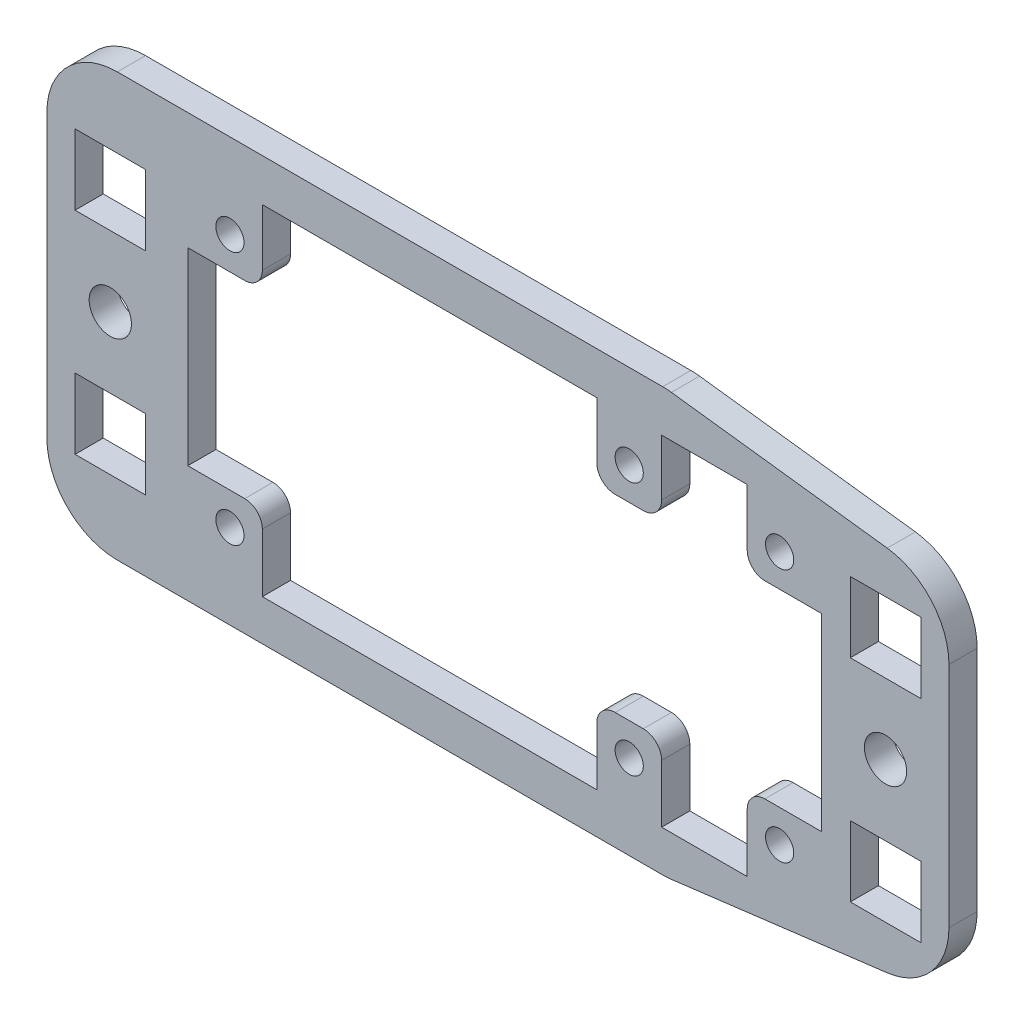
from build123d import *

# Parameters (mm, degrees)
ESQUISSE1_R        = 1.5
ESQUISSE1_W        = 5
ESQUISSE1_H        = 5
BOSS_EXTRU_1_DEPTH = 2
FILLET1_R          = 5


with BuildPart() as part:
    # Esquisse1 → Boss.-Extru.1 (new body)
    with BuildSketch(Plane.XY):
        Polygon((-10, -15), (-10, 15), (34, 15), (54, 12.5), (54, -12.5), (34, -15), align=None)
        with Locations((-5.5, 0)):
            Circle(ESQUISSE1_R, mode=Mode.SUBTRACT)
        with Locations((49.5, 0)):
            Circle(ESQUISSE1_R, mode=Mode.SUBTRACT)
        with BuildLine():
            Line((4.03758425, 6.699965485), (0, 6.699965485))
            Line((0, 6.699965485), (0, -6.699965485))
            Line((0, -6.699965485), (4.037591434, -6.700034515))
            ThreePointArc((4.037591434, -6.700034515), (4.921479782, -7.066148374), (5.28759897, -7.950034515))
            Line((5.28759897, -7.950034515), (5.28759897, -12.100034515))
            Line((5.28759897, -12.100034515), (29.015776303, -12.100034515))
            Line((29.015776303, -12.100034515), (29.015776303, -8.000038733))
            ThreePointArc((29.015776303, -8.000038733), (29.396536008, -7.080797161), (30.315776345, -6.700034473))
            Line((30.315776345, -6.700034473), (32.315776344, -6.700034473))
            ThreePointArc((32.315776344, -6.700034473), (33.23501504, -7.080795537), (33.615776345, -8.000034132))
            Line((33.615776345, -8.000034132), (33.615776345, -12.100034515))
            Line((33.615776345, -12.100034515), (39.687598777, -12.100034515))
            Line((39.687598777, -12.100034515), (39.687598777, -7.950039613))
            ThreePointArc((39.687598777, -7.950039613), (40.053713738, -7.066152541), (40.937599481, -6.70003437))
            Line((40.937599481, -6.70003437), (44.975197892, -6.70003437))
            Line((44.975197892, -6.70003437), (44.975197892, 6.699965437))
            Line((44.975197892, 6.699965437), (40.9376034, 6.699965437))
            ThreePointArc((40.9376034, 6.699965437), (40.053716981, 7.066080502), (39.68759897, 7.949965701))
            Line((39.68759897, 7.949965701), (39.68759897, 11.987564455))
            Line((39.68759897, 11.987564455), (33.615776432, 11.987564455))
            Line((33.615776432, 11.987564455), (33.615776432, 7.999969389))
            ThreePointArc((33.615776432, 7.999969389), (33.235016597, 7.080728053), (32.315776389, 6.699965495))
            Line((32.315776389, 6.699965495), (30.31577639, 6.699965495))
            ThreePointArc((30.31577639, 6.699965495), (29.396537621, 7.080726637), (29.015776399, 7.999965373))
            Line((29.015776399, 7.999965373), (29.015776399, 11.987564455))
            Line((29.015776399, 11.987564455), (5.28759897, 11.987564455))
            Line((5.28759897, 11.987564455), (5.28759897, 7.949965485))
            ThreePointArc((5.28759897, 7.949965485), (4.921477242, 7.066076805), (4.03758425, 6.699965485))
        make_face(mode=Mode.SUBTRACT)
        with BuildLine():
            ThreePointArc((31.315776387, 9.999965485), (30.315776387, 8.999965485), (31.315776387, 7.999965485))
            ThreePointArc((31.315776387, 7.999965485), (32.315776387, 8.999965485), (31.315776387, 9.999965485))
        make_face(mode=Mode.SUBTRACT)
        with BuildLine():
            ThreePointArc((42.98759897, 8.999965485), (41.98759897, 9.999965485), (40.98759897, 8.999965485))
            ThreePointArc((40.98759897, 8.999965485), (41.98759897, 7.999965485), (42.98759897, 8.999965485))
        make_face(mode=Mode.SUBTRACT)
        with BuildLine():
            ThreePointArc((42.98759897, -9.000034515), (41.98759897, -8.000034515), (40.98759897, -9.000034515))
            ThreePointArc((40.98759897, -9.000034515), (41.98759897, -10.000034515), (42.98759897, -9.000034515))
        make_face(mode=Mode.SUBTRACT)
        with BuildLine():
            ThreePointArc((31.315776387, -8.000034515), (30.315776387, -9.000034515), (31.315776387, -10.000034515))
            ThreePointArc((31.315776387, -10.000034515), (32.315776387, -9.000034515), (31.315776387, -8.000034515))
        make_face(mode=Mode.SUBTRACT)
        with BuildLine():
            ThreePointArc((1.98759897, -9.000034515), (2.98759897, -10.000034515), (3.98759897, -9.000034515))
            ThreePointArc((3.98759897, -9.000034515), (2.98759897, -8.000034515), (1.98759897, -9.000034515))
        make_face(mode=Mode.SUBTRACT)
        with BuildLine():
            ThreePointArc((1.98759897, 8.999965485), (2.98759897, 7.999965485), (3.98759897, 8.999965485))
            ThreePointArc((3.98759897, 8.999965485), (2.98759897, 9.999965485), (1.98759897, 8.999965485))
        make_face(mode=Mode.SUBTRACT)
        with Locations((-5.5, 7.5)):
            Rectangle(ESQUISSE1_W, ESQUISSE1_H, mode=Mode.SUBTRACT)
        with Locations((-5.5, -7.5)):
            Rectangle(ESQUISSE1_W, ESQUISSE1_H, mode=Mode.SUBTRACT)
        with Locations((49.5, 7.5)):
            Rectangle(ESQUISSE1_W, ESQUISSE1_H, mode=Mode.SUBTRACT)
        with Locations((49.5, -7.5)):
            Rectangle(ESQUISSE1_W, ESQUISSE1_H, mode=Mode.SUBTRACT)
    extrude(amount=BOSS_EXTRU_1_DEPTH)

    # Fillet1
    fillet1_edges = [part.edges().sort_by_distance(p)[0] for p in [
        (-10, -15, 1),
        (-10, 15, 1),
        (34, 15, 1),
        (54, 12.5, 1),
        (54, -12.5, 1),
        (34, -15, 1),
    ]]
    fillet(fillet1_edges, radius=FILLET1_R)


solid = part.part
